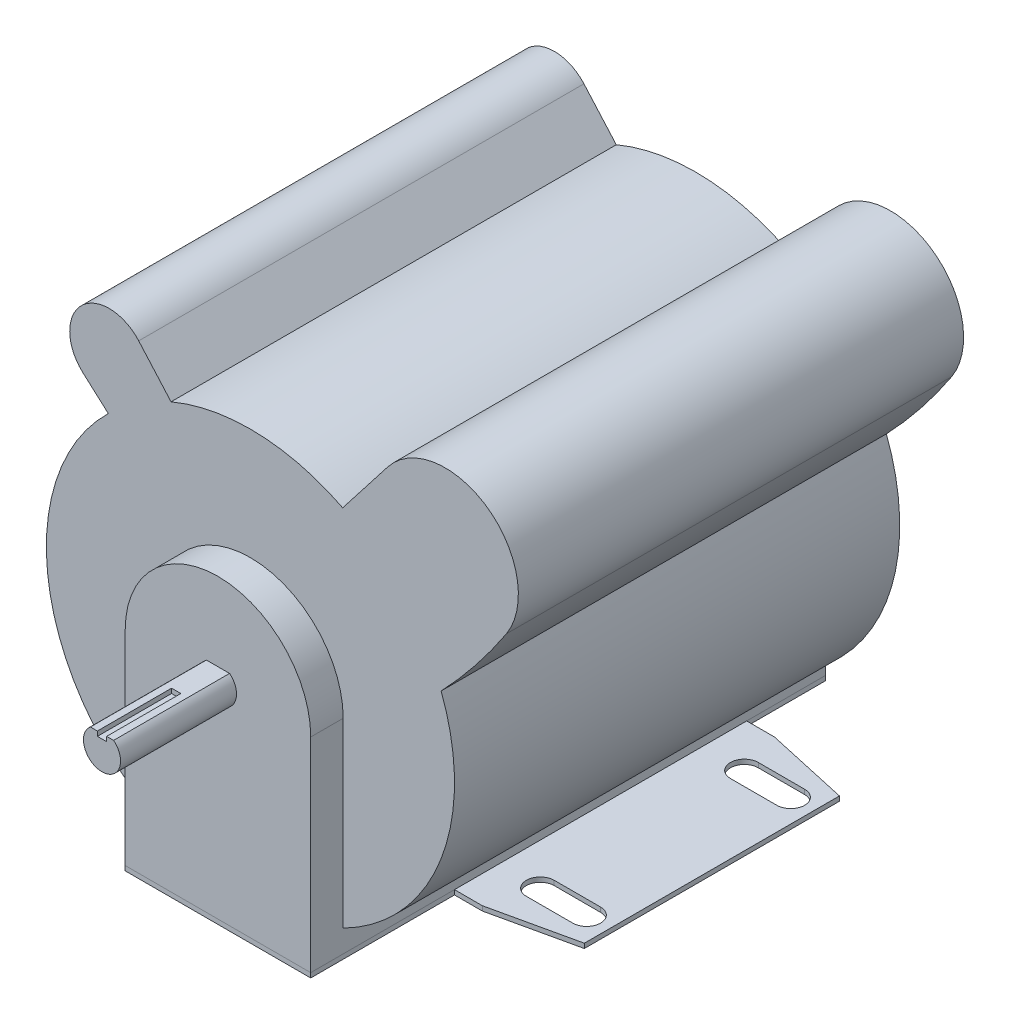
from build123d import *

# Parameters (mm, degrees)
BOSS_EXTRUDE1_DEPTH      = 50.8
SKETCH2_R                = 69.85
BOSS_EXTRUDE2_DEPTH      = 152.4
BOSS_EXTRUDE3_DEPTH      = 11.1125
BOSS_EXTRUDE3_DEPTH_BACK = 165.1
BOSS_EXTRUDE4_DEPTH      = 1.5875
CUT_EXTRUDE1_DEPTH       = 1.5875
BOSS_EXTRUDE5_DEPTH      = 152.4
SKETCH7_W                = 3.175
SKETCH7_H                = 1.5875
CUT_EXTRUDE2_DEPTH       = 25.4


with BuildPart() as part:
    # Sketch1 → Boss-Extrude1 (new body)
    with BuildSketch(Plane.XY):
        with BuildLine():
            Line((-3.96875, 4.956967161), (3.96875, 4.956967161))
            ThreePointArc((3.96875, 4.956967161), (0, -6.35), (-3.96875, 4.956967161))
        make_face()
    extrude(amount=BOSS_EXTRUDE1_DEPTH)

    # Sketch2 → Boss-Extrude2 (add)
    with BuildSketch(Plane(origin=(0, 0, 0), x_dir=(-1, 0, 0), z_dir=(0, 0, -1))):
        with Locations(Location((0, 0, 0), (0, 0, 180))):
            Circle(SKETCH2_R)
    extrude(amount=BOSS_EXTRUDE2_DEPTH)

    # Sketch3 → Boss-Extrude3 (add, two sides: drawn at the far end of the back side and taken through both)
    with BuildSketch(Plane.XY.offset(-BOSS_EXTRUDE3_DEPTH_BACK)):
        with BuildLine():
            Line((-31.75, 0), (-31.75, -69.85))
            Line((-31.75, -69.85), (31.75, -69.85))
            Line((31.75, -69.85), (31.75, 0))
            ThreePointArc((31.75, 0), (0, 31.75), (-31.75, 0))
        make_face()
    extrude(amount=BOSS_EXTRUDE3_DEPTH + BOSS_EXTRUDE3_DEPTH_BACK)

    # Sketch6 → Boss-Extrude5 (add)
    with BuildSketch(Plane.XY):
        with BuildLine():
            Line((-57.339496862, 57.877511192), (-43.213350378, 45.2729749))
            Line((-43.213350378, 45.2729749), (-24.981535219, 61.868601519))
            Line((-24.981535219, 61.868601519), (-38.242972103, 76.879791128))
            ThreePointArc((-38.242972103, 76.879791128), (-57.873547409, 77.510968918), (-57.339496862, 57.877511192))
        make_face()
        with BuildLine():
            Line((22.296433765, 50.36440818), (46.944158333, 82.054339768))
            ThreePointArc((46.944158333, 82.054339768), (81.255533225, 87.039254438), (87.603107082, 52.953654438))
            ThreePointArc((87.603107082, 52.953654438), (74.164851505, 34.827489865), (58.76527868, 18.335136731))
            ThreePointArc((58.76527868, 18.335136731), (42.207462237, 36.258772628), (22.296433765, 50.36440818))
        make_face()
    extrude(amount=-BOSS_EXTRUDE5_DEPTH)

    # Sketch7 → Cut-Extrude2 (cut)
    with BuildSketch(Plane.XY.offset(50.8)):
        with Locations((0, 4.163217161)):
            Rectangle(SKETCH7_W, SKETCH7_H)
    extrude(amount=-CUT_EXTRUDE2_DEPTH, mode=Mode.SUBTRACT)


with BuildPart() as body_2:
    # Sketch4 → Boss-Extrude4 (new body)
    with BuildSketch(Plane.XZ.offset(69.85)):
        Polygon((-41.275, -38.1), (-69.85, -44.45), (-69.85, -131.7625), (-41.275, -138.1125), (-31.75, -138.1125), (-31.75, -165.1), (31.75, -165.1), (31.75, -138.1125), (41.275, -138.1125), (69.85, -131.7625), (69.85, -44.45), (41.275, -38.1), (31.75, -38.1), (31.75, 11.1125), (-31.75, 11.1125), (-31.75, -38.1), align=None)
    extrude(amount=BOSS_EXTRUDE4_DEPTH)

    # Sketch5 → Cut-Extrude1 (cut)
    with BuildSketch(Plane.XZ.offset(71.4375)):
        with BuildLine():
            Line((-61.9125, -48.41875), (-46.0375, -48.41875))
            ThreePointArc((-46.0375, -48.41875), (-41.275, -53.18125), (-46.0375, -57.94375))
            Line((-46.0375, -57.94375), (-61.9125, -57.94375))
            ThreePointArc((-61.9125, -57.94375), (-66.675, -53.18125), (-61.9125, -48.41875))
        make_face()
        with BuildLine():
            Line((-61.9125, -127.79375), (-46.0375, -127.79375))
            ThreePointArc((-46.0375, -127.79375), (-41.275, -123.03125), (-46.0375, -118.26875))
            Line((-46.0375, -118.26875), (-61.9125, -118.26875))
            ThreePointArc((-61.9125, -118.26875), (-66.675, -123.03125), (-61.9125, -127.79375))
        make_face()
    cut_extrude1 = extrude(amount=-CUT_EXTRUDE1_DEPTH, mode=Mode.SUBTRACT)

    # Mirror1: Cut-Extrude1 across plane
    add(cut_extrude1.mirror(Plane(origin=(0, 0, 0), x_dir=(0, 0, 1), z_dir=(1, 0, 0))), mode=Mode.SUBTRACT)


solid = Compound([part.part, body_2.part])
